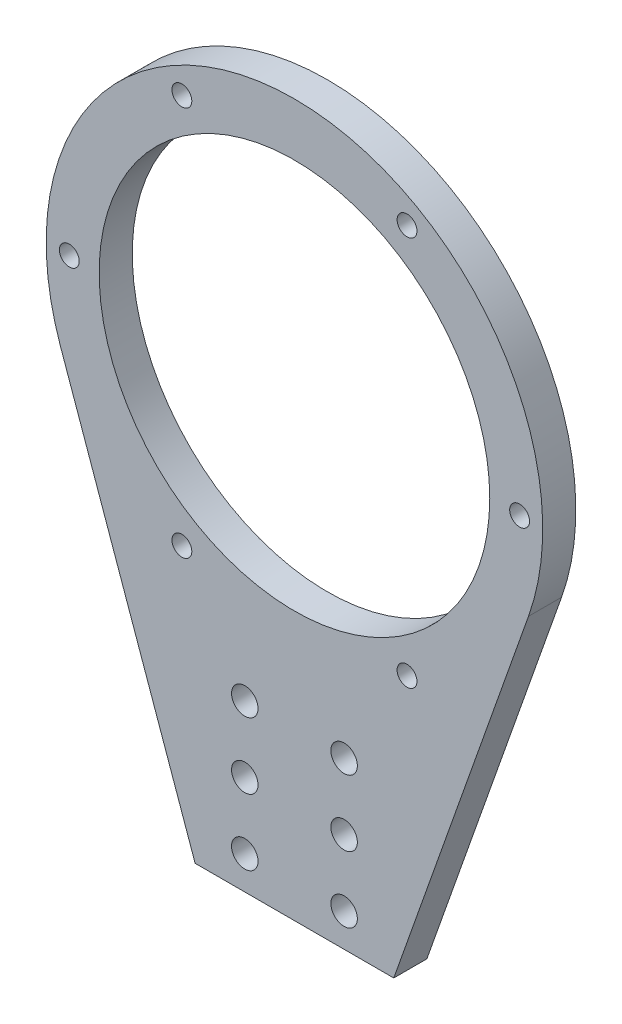
from build123d import *

# Parameters (mm, degrees)
SKETCH1_R           = 37.5
SKETCH1_R_2         = 29.5
BOSS_EXTRUDE1_DEPTH = 5
SKETCH9_R           = 1.5
CUT_EXTRUDE5_DEPTH  = 7
SKETCH10_R          = 2
CUT_EXTRUDE6_DEPTH  = 7


with BuildPart() as part:
    # Sketch1 → Boss-Extrude1 (new body)
    # profile 1 of 2: a face of its own
    with BuildSketch(Plane.XY):
        Circle(SKETCH1_R)
        Circle(SKETCH1_R_2, mode=Mode.SUBTRACT)
    # profile 2 of 2: a face of its own
    with BuildSketch(Plane.XY):
        with BuildLine():
            Line((-15, -70), (15, -70))
            Line((15, -70), (35.350308448, -12.514219618))
            ThreePointArc((35.350308448, -12.514219618), (0, -37.5), (-35.350308448, -12.514219618))
            Line((-35.350308448, -12.514219618), (-15, -70))
        make_face()
    extrude(amount=BOSS_EXTRUDE1_DEPTH)

    # Sketch9 → Cut-Extrude5 (cut)
    with BuildSketch(Plane.XY.offset(5)):
        with Locations((17.005, 29.453523983)):
            Circle(SKETCH9_R)
        with Locations((34.01, 0)):
            Circle(SKETCH9_R)
        with Locations((17.005, -29.453523983)):
            Circle(SKETCH9_R)
        with Locations((-17.005, -29.453523983)):
            Circle(SKETCH9_R)
        with Locations((-34.01, 0)):
            Circle(SKETCH9_R)
        with Locations((-17.005, 29.453523983)):
            Circle(SKETCH9_R)
    extrude(amount=-CUT_EXTRUDE5_DEPTH, mode=Mode.SUBTRACT)

    # Sketch10 → Cut-Extrude6 (cut)
    with BuildSketch(Plane.XY.offset(5)):
        with Locations((7.5, -55)):
            Circle(SKETCH10_R)
        with Locations((7.5, -65)):
            Circle(SKETCH10_R)
        with Locations((-7.5, -65)):
            Circle(SKETCH10_R)
        with Locations((-7.5, -55)):
            Circle(SKETCH10_R)
        with Locations((-7.5, -45)):
            Circle(SKETCH10_R)
        with Locations((7.5, -45)):
            Circle(SKETCH10_R)
    extrude(amount=-CUT_EXTRUDE6_DEPTH, mode=Mode.SUBTRACT)


solid = part.part
